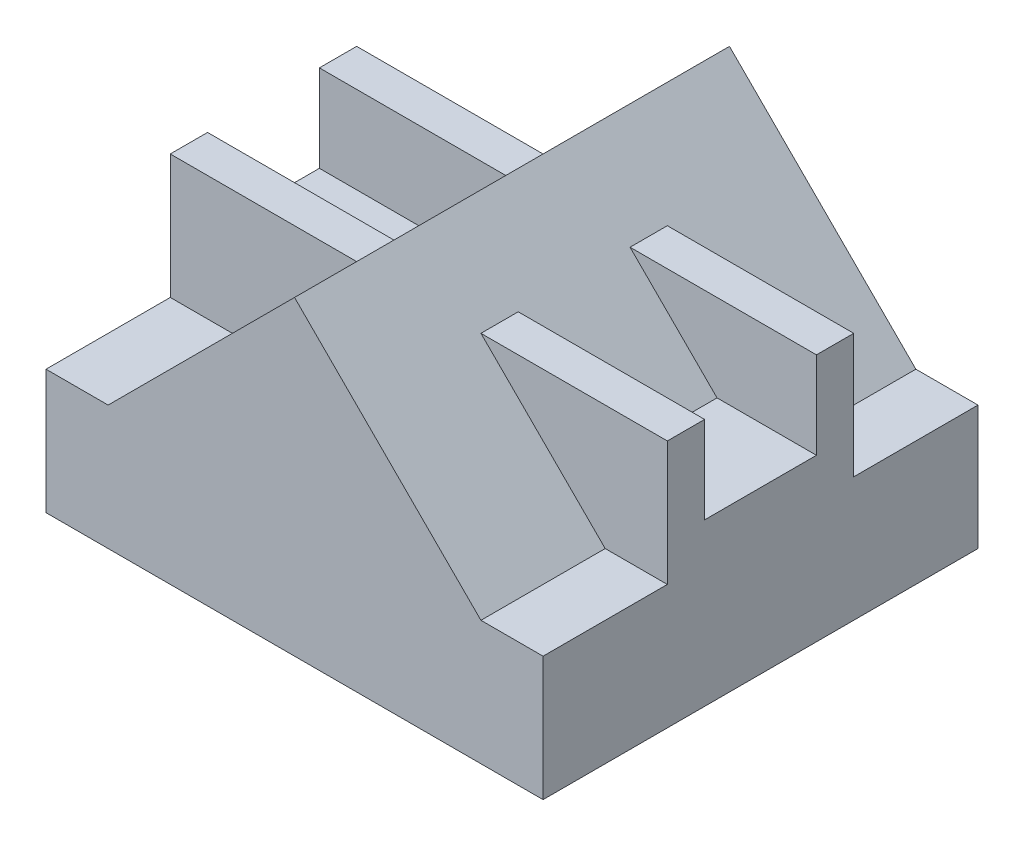
from build123d import *

# Parameters (mm, degrees)
BOSS_EXTRUDE1_DEPTH = 175
BOSS_EXTRUDE2_DEPTH = 200


with BuildPart() as part:
    # Sketch1 → Boss-Extrude1 (new body)
    with BuildSketch(Plane.XY):
        Polygon((0, 0), (100, 0), (100, 50), (75, 50), (0, 125), align=None)
        Polygon((-100, 0), (0, 0), (0, 125), (-75, 50), (-100, 50), align=None)
    extrude(amount=-BOSS_EXTRUDE1_DEPTH)

    # Sketch2 → Boss-Extrude2 (add)
    with BuildSketch(Plane(origin=(100, 0, 0), x_dir=(0, 0, -1), z_dir=(1, 0, 0))):
        Polygon((0, 50), (0, 0), (175, 0), (175, 50), (125, 50), (125, 100), (110, 100), (110, 65), (65, 65), (65, 100), (50, 100), (50, 50), align=None)
    extrude(amount=-BOSS_EXTRUDE2_DEPTH)


solid = part.part
